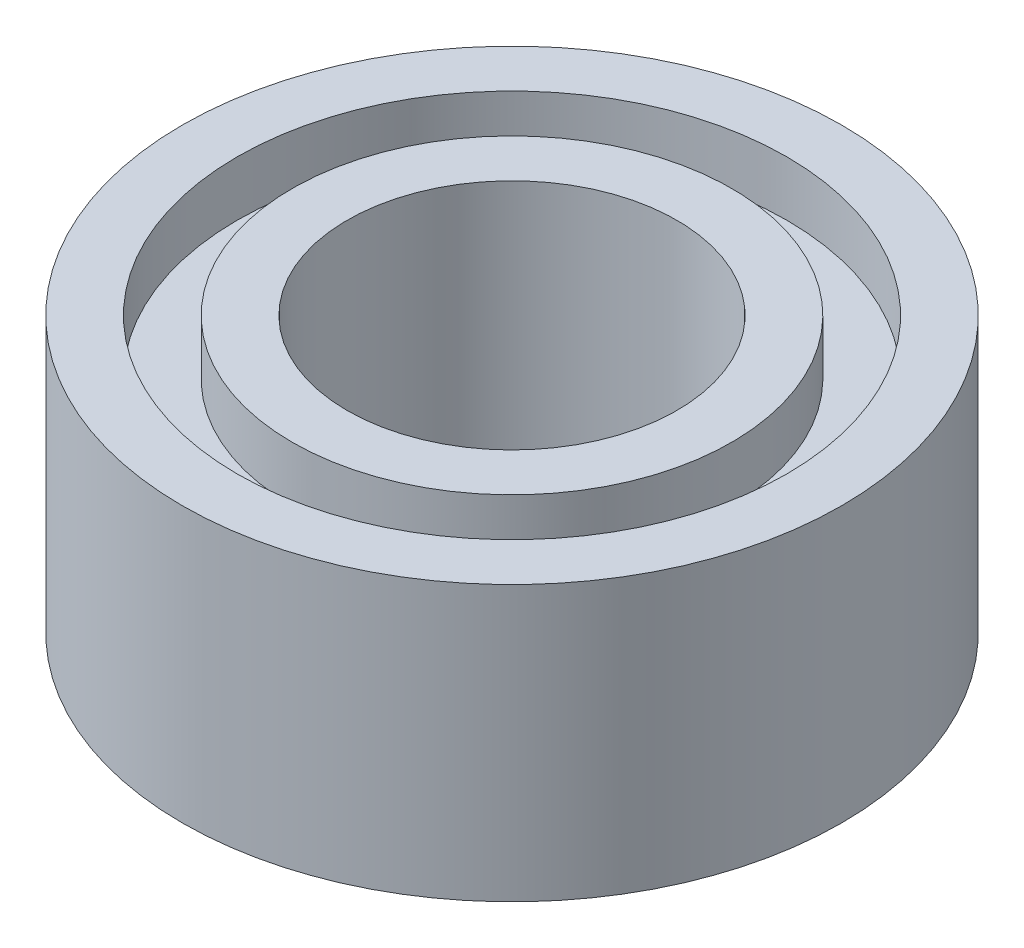
from build123d import *

# Parameters (mm, degrees)
SKETCH_1_R          = 3
SKETCH_1_R_2        = 1.5
EXTRUDE_1_DEPTH     = 2.5
SKETCH_2_R          = 2.5
SKETCH_2_R_2        = 2
CUT_EXTRUDE_1_DEPTH = 0.5
CUT_EXTRUDE_START   = -0.5
SKETCH_3_R          = 2.5
SKETCH_3_R_2        = 2
CUT_EXTRUDE_2_DEPTH = 0.5


with BuildPart() as part:
    # 草图1 → 凸台-拉伸1 (new body)
    with BuildSketch(Plane(origin=(0, 0, 0), x_dir=(1, 0, 0), z_dir=(0, 1, 0))):
        with Locations(Location((0, 0, 0), (0, 0, 270))):
            Circle(SKETCH_1_R)
        with Locations(Location((0, 0, 0), (0, 0, 270))):
            Circle(SKETCH_1_R_2, mode=Mode.SUBTRACT)
    extrude(amount=EXTRUDE_1_DEPTH)

    # 草图2 → 切除-拉伸1 (cut)
    with BuildSketch(Plane(origin=(0, 2.5, 0), x_dir=(1, 0, 0), z_dir=(0, 1, 0))):
        with Locations(Location((0, 0, 0), (0, 0, 270))):
            Circle(SKETCH_2_R)
        with Locations(Location((0, 0, 0), (0, 0, 270))):
            Circle(SKETCH_2_R_2, mode=Mode.SUBTRACT)
    extrude(amount=-CUT_EXTRUDE_1_DEPTH, mode=Mode.SUBTRACT)

    # 草图3 → 切除-拉伸2 (cut)
    with BuildSketch(Plane.XZ.offset(CUT_EXTRUDE_START)):
        with Locations(Location((0, 0, 0), (0, 0, 90))):
            Circle(SKETCH_3_R)
        with Locations(Location((0, 0, 0), (0, 0, 90))):
            Circle(SKETCH_3_R_2, mode=Mode.SUBTRACT)
    extrude(amount=CUT_EXTRUDE_2_DEPTH, mode=Mode.SUBTRACT)


solid = part.part
